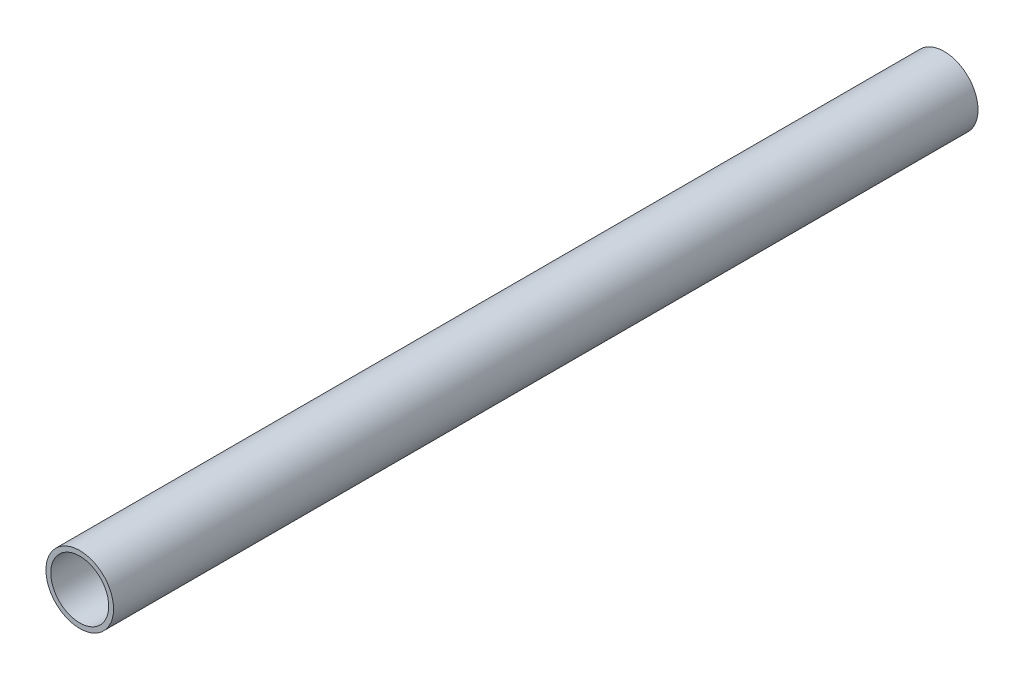
from build123d import *

# Parameters (mm, degrees)
SKETCH1_R           = 11.1125
SKETCH1_R_2         = 9.525
BOSS_EXTRUDE1_DEPTH = 142.113


with BuildPart() as part:
    # Sketch1 → Boss-Extrude1 (new, symmetric)
    with BuildSketch(Plane.XY):
        Circle(SKETCH1_R)
        Circle(SKETCH1_R_2, mode=Mode.SUBTRACT)
    extrude(amount=BOSS_EXTRUDE1_DEPTH, both=True)


solid = part.part
